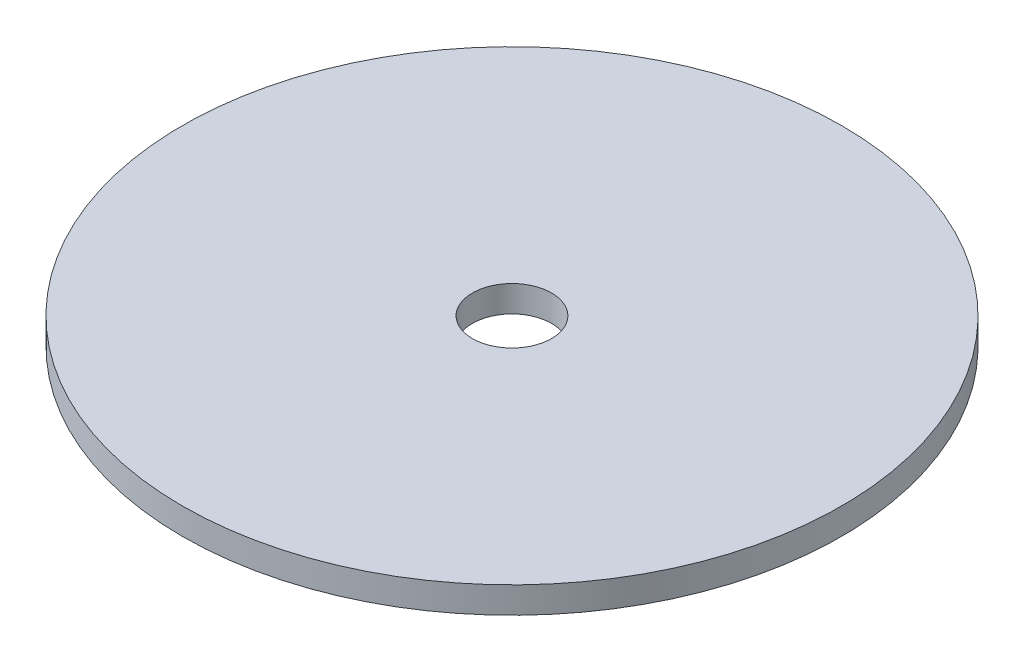
from build123d import *

# Parameters (mm, degrees)
SKETCH1_R           = 12.5
SKETCH1_R_2         = 1.5
BOSS_EXTRUDE1_DEPTH = 1


with BuildPart() as part:
    # Sketch1 → Boss-Extrude1 (new body)
    with BuildSketch(Plane(origin=(0, 0, 0), x_dir=(1, 0, 0), z_dir=(0, 1, 0))):
        with Locations(Location((0, 0, 0), (0, 0, 270))):
            Circle(SKETCH1_R)
        with Locations(Location((0, 0, 0), (0, 0, 270))):
            Circle(SKETCH1_R_2, mode=Mode.SUBTRACT)
    extrude(amount=BOSS_EXTRUDE1_DEPTH)


solid = part.part
